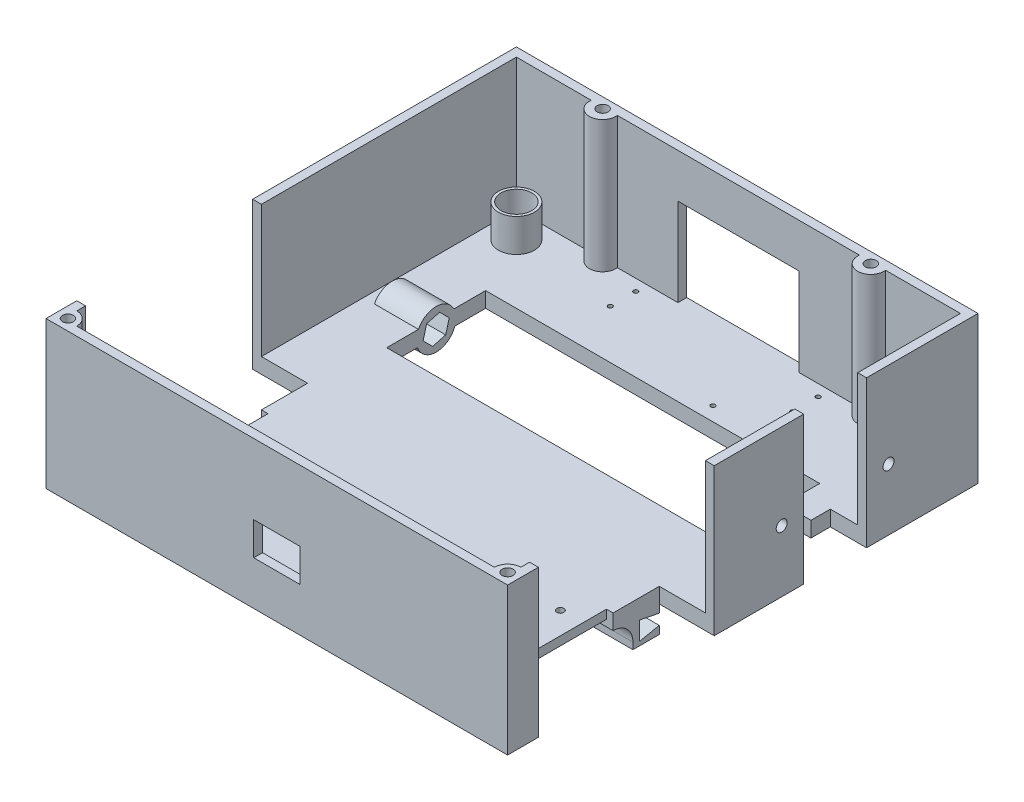
from build123d import *

# Parameters (mm, degrees)
SKETCH1_W           = 210
SKETCH1_H           = 214
BOSS_EXTRUDE1_DEPTH = 7
SKETCH2_W           = 210
SKETCH2_H           = 214
SKETCH2_W_2         = 202
SKETCH2_H_2         = 206
BOSS_EXTRUDE2_DEPTH = 60
SKETCH3_R           = 1.6
CUT_EXTRUDE1_DEPTH  = 306.771156259
SKETCH4_W           = 25
SKETCH4_H           = 80
CUT_EXTRUDE2_DEPTH  = 67
SKETCH5_W           = 42
SKETCH5_H           = 38
CUT_EXTRUDE3_DEPTH  = 3
SKETCH6_W           = 3
SKETCH6_H           = 38
CUT_EXTRUDE4_DEPTH  = 307.581147496
SKETCH7_W           = 152
SKETCH7_H           = 45
CUT_EXTRUDE5_DEPTH  = 306.771156259
SKETCH8_R           = 9
BOSS_EXTRUDE3_DEPTH = 20
SKETCH9_W           = 12.5
SKETCH9_H           = 12
CUT_EXTRUDE6_DEPTH  = 20
SKETCH10_W          = 160
SKETCH10_H          = 12
BOSS_EXTRUDE4_DEPTH = 12
SKETCH11_W          = 9
SKETCH11_H          = 4.8
CUT_EXTRUDE7_DEPTH  = 291.706037089
FILLET1_R           = 9
SKETCH12_R          = 8.2
SKETCH12_R_2        = 7
BOSS_EXTRUDE5_DEPTH = 15
CUT_EXTRUDE8_START  = -12
SKETCH13_R          = 7
CUT_EXTRUDE8_DEPTH  = 12
SKETCH14_W          = 16.5
SKETCH14_H          = 28.6
CUT_EXTRUDE9_DEPTH  = 308.221418524
SKETCH15_W          = 21
SKETCH15_H          = 15
CUT_EXTRUDE10_DEPTH = 30
CUT_EXTRUDE11_DEPTH = 10
BOSS_EXTRUDE6_REACH = 312.06
SKETCH17_R          = 6
CUT_EXTRUDE12_REACH = 312.06
SKETCH18_R          = 2.5
BOSS_EXTRUDE7_REACH = 312.06
SKETCH22_R          = 6
CUT_EXTRUDE14_REACH = 312.06
SKETCH23_R          = 2.5
SKETCH24_R          = 3
SKETCH24_R_2        = 5.798017453
CUT_EXTRUDE15_DEPTH = 3
SKETCH25_R          = 1
CUT_EXTRUDE16_DEPTH = 307.581147496
SKETCH29_W          = 55
SKETCH29_H          = 40
CUT_EXTRUDE17_DEPTH = 17
SKETCH30_R          = 1
CUT_EXTRUDE18_DEPTH = 17
SKETCH31_R          = 2.5
CUT_EXTRUDE19_DEPTH = 17
SKETCH32_W          = 15
SKETCH32_H          = 19
CUT_EXTRUDE20_DEPTH = 3
SKETCH34_R          = 1.5
CUT_EXTRUDE21_DEPTH = 306.771156259


with BuildPart() as part:
    # Sketch1 → Boss-Extrude1 (new body)
    with BuildSketch(Plane(origin=(0, 0, 0), x_dir=(1, 0, 0), z_dir=(0, 1, 0))):
        with Locations((105, 107)):
            Rectangle(SKETCH1_W, SKETCH1_H)
    extrude(amount=BOSS_EXTRUDE1_DEPTH)

    # Sketch2 → Boss-Extrude2 (add)
    with BuildSketch(Plane(origin=(0, 7, 0), x_dir=(1, 0, 0), z_dir=(0, 1, 0))):
        with Locations((105, 107)):
            Rectangle(SKETCH2_W, SKETCH2_H)
        with Locations((105, 107)):
            Rectangle(SKETCH2_W_2, SKETCH2_H_2, mode=Mode.SUBTRACT)
    extrude(amount=BOSS_EXTRUDE2_DEPTH)

    # Sketch3 → Cut-Extrude1 (cut, through all)
    with BuildSketch(Plane(origin=(0, 7, 0), x_dir=(1, 0, 0), z_dir=(0, 1, 0))):
        with Locations(Location((38, 62, 0), (0, 0, 270))):
            Circle(SKETCH3_R)
        with Locations(Location((38, 46, 0), (0, 0, 270))):
            Circle(SKETCH3_R)
        with Locations(Location((52, 62, 0), (0, 0, 270))):
            Circle(SKETCH3_R)
        with Locations(Location((52, 46, 0), (0, 0, 270))):
            Circle(SKETCH3_R)
        with Locations(Location((172, 62, 0), (0, 0, 270))):
            Circle(SKETCH3_R)
        with Locations(Location((172, 46, 0), (0, 0, 270))):
            Circle(SKETCH3_R)
        with Locations(Location((158, 62, 0), (0, 0, 270))):
            Circle(SKETCH3_R)
        with Locations(Location((158, 46, 0), (0, 0, 270))):
            Circle(SKETCH3_R)
    extrude(amount=-CUT_EXTRUDE1_DEPTH, mode=Mode.SUBTRACT)

    # Sketch4 → Cut-Extrude2 (cut)
    with BuildSketch(Plane(origin=(0, 0, 0), x_dir=(-1, 0, 0), z_dir=(0, -1, 0))):
        with Locations((-12.5, 54)):
            Rectangle(SKETCH4_W, SKETCH4_H)
        with Locations((-197.5, 54)):
            Rectangle(SKETCH4_W, SKETCH4_H)
    extrude(amount=-CUT_EXTRUDE2_DEPTH, mode=Mode.SUBTRACT)

    # Sketch5 → Cut-Extrude3 (cut)
    with BuildSketch(Plane(origin=(0, 0, 0), x_dir=(-1, 0, 0), z_dir=(0, -1, 0))):
        with Locations((-46, 54)):
            Rectangle(SKETCH5_W, SKETCH5_H)
        with Locations((-164, 54)):
            Rectangle(SKETCH5_W, SKETCH5_H)
    extrude(amount=-CUT_EXTRUDE3_DEPTH, mode=Mode.SUBTRACT)

    # Sketch6 → Cut-Extrude4 (cut, through all)
    with BuildSketch(Plane.XZ.offset(-3)):
        with Locations((26.5, -54)):
            Rectangle(SKETCH6_W, SKETCH6_H)
        with Locations((183.5, -54)):
            Rectangle(SKETCH6_W, SKETCH6_H)
    extrude(amount=-CUT_EXTRUDE4_DEPTH, mode=Mode.SUBTRACT)

    # Sketch7 → Cut-Extrude5 (cut, through all)
    with BuildSketch(Plane(origin=(0, 7, 0), x_dir=(1, 0, 0), z_dir=(0, 1, 0))):
        with Locations((105, 148.5)):
            Rectangle(SKETCH7_W, SKETCH7_H)
    extrude(amount=-CUT_EXTRUDE5_DEPTH, mode=Mode.SUBTRACT)

    # Sketch8 → Boss-Extrude3 (add)
    with BuildSketch(Plane(origin=(29, 0, 0), x_dir=(0, 0, -1), z_dir=(1, 0, 0))):
        with Locations((148.5, 3)):
            Circle(SKETCH8_R)
    extrude(amount=-BOSS_EXTRUDE3_DEPTH)

    # Sketch9 → Cut-Extrude6 (cut)
    with BuildSketch(Plane(origin=(0, 7, 0), x_dir=(1, 0, 0), z_dir=(0, 1, 0))):
        with Locations((187.25, 148.5)):
            Rectangle(SKETCH9_W, SKETCH9_H)
    extrude(amount=-CUT_EXTRUDE6_DEPTH, mode=Mode.SUBTRACT)

    # Sketch10 → Boss-Extrude4 (add)
    with BuildSketch(Plane.XZ):
        with Locations((105, -88)):
            Rectangle(SKETCH10_W, SKETCH10_H)
    extrude(amount=BOSS_EXTRUDE4_DEPTH)

    # Sketch11 → Cut-Extrude7 (cut, through all)
    with BuildSketch(Plane.ZY.offset(-25)):
        with Locations((-89.5, -6)):
            Rectangle(SKETCH11_W, SKETCH11_H)
        Polygon((-85, -3.6), (-85, -1.8), (-94, -3.6), align=None)
        Polygon((-85, -10.2), (-94, -8.4), (-85, -8.4), align=None)
    extrude(amount=-CUT_EXTRUDE7_DEPTH, mode=Mode.SUBTRACT)

    # Fillet1
    fillet1_edges = [part.edges().sort_by_distance(p)[0] for p in [
        (105, 0, -82),
    ]]
    fillet(fillet1_edges, radius=FILLET1_R)

    # Sketch12 → Boss-Extrude5 (add)
    # profile 1 of 2: a face of its own
    with BuildSketch(Plane(origin=(0, 7, 0), x_dir=(1, 0, 0), z_dir=(0, 1, 0))):
        with Locations(Location((16, 198, 0), (0, 0, 90))):
            Circle(SKETCH12_R)
        with Locations(Location((16, 198, 0), (0, 0, 270))):
            Circle(SKETCH12_R_2, mode=Mode.SUBTRACT)
    # profile 2 of 2: a face of its own
    with BuildSketch(Plane(origin=(0, 7, 0), x_dir=(1, 0, 0), z_dir=(0, 1, 0))):
        with Locations(Location((194, 198, 0), (0, 0, 90))):
            Circle(SKETCH12_R)
        with Locations(Location((194, 198, 0), (0, 0, 270))):
            Circle(SKETCH12_R_2, mode=Mode.SUBTRACT)
    extrude(amount=BOSS_EXTRUDE5_DEPTH)

    # Sketch13 → Cut-Extrude8 (cut)
    with BuildSketch(Plane(origin=(0, 7, 0), x_dir=(1, 0, 0), z_dir=(0, 1, 0)).offset(CUT_EXTRUDE8_START)):
        with Locations(Location((16, 198, 0), (0, 0, 90))):
            Circle(SKETCH13_R)
        with Locations(Location((194, 198, 0), (0, 0, 90))):
            Circle(SKETCH13_R)
    extrude(amount=CUT_EXTRUDE8_DEPTH, mode=Mode.SUBTRACT)

    # Sketch14 → Cut-Extrude9 (cut, through all)
    with BuildSketch(Plane.XZ):
        with Locations((201.75, -148.99190775)):
            Rectangle(SKETCH14_W, SKETCH14_H)
    extrude(amount=-CUT_EXTRUDE9_DEPTH, mode=Mode.SUBTRACT)

    # Sketch15 → Cut-Extrude10 (cut)
    with BuildSketch(Plane.XY):
        with Locations((105, 27.5)):
            Rectangle(SKETCH15_W, SKETCH15_H)
    extrude(amount=-CUT_EXTRUDE10_DEPTH, mode=Mode.SUBTRACT)

    # Sketch16 → Cut-Extrude11 (cut)
    with BuildSketch(Plane(origin=(29, 0, 0), x_dir=(0, 0, -1), z_dir=(1, 0, 0))):
        Polygon((154.446285201, 4.569774603), (150.113677916, 8.934521344), (144.167392715, 7.364746741), (142.553714799, 1.430225397), (146.886322084, -2.934521344), (152.832607285, -1.364746741), align=None)
    extrude(amount=-CUT_EXTRUDE11_DEPTH, mode=Mode.SUBTRACT)

    # Sketch17 → Boss-Extrude6 (add, up to next)
    with BuildSketch(Plane(origin=(0, 67, 0), x_dir=(1, 0, 0), z_dir=(0, 1, 0)), mode=Mode.PRIVATE) as boss_extrude6_sk1:
        with Locations((4, 4)):
            Circle(SKETCH17_R)
    boss_extrude6_tool1 = extrude(boss_extrude6_sk1.sketch, amount=-BOSS_EXTRUDE6_REACH, mode=Mode.PRIVATE) - part.part
    # Sketch17 → Boss-Extrude6 (add, up to next)
    with BuildSketch(Plane(origin=(0, 67, 0), x_dir=(1, 0, 0), z_dir=(0, 1, 0)), mode=Mode.PRIVATE) as boss_extrude6_sk2:
        with Locations((206, 4)):
            Circle(SKETCH17_R)
    boss_extrude6_tool2 = extrude(boss_extrude6_sk2.sketch, amount=-BOSS_EXTRUDE6_REACH, mode=Mode.PRIVATE) - part.part
    add(boss_extrude6_tool1.solids().sort_by_distance((4, 67, -4))[0])
    add(boss_extrude6_tool2.solids().sort_by_distance((206, 67, -4))[0])

    # Sketch18 → Cut-Extrude12 (cut, up to next)
    with BuildSketch(Plane(origin=(0, 67, 0), x_dir=(1, 0, 0), z_dir=(0, 1, 0)), mode=Mode.PRIVATE) as cut_extrude12_sk1:
        with Locations(Location((5, 5, 0), (0, 0, 270))):
            Circle(SKETCH18_R)
    cut_extrude12_tool1 = extrude(cut_extrude12_sk1.sketch, amount=-CUT_EXTRUDE12_REACH, mode=Mode.PRIVATE) & part.part
    # Sketch18 → Cut-Extrude12 (cut, up to next)
    with BuildSketch(Plane(origin=(0, 67, 0), x_dir=(1, 0, 0), z_dir=(0, 1, 0)), mode=Mode.PRIVATE) as cut_extrude12_sk2:
        with Locations(Location((205, 5, 0), (0, 0, 270))):
            Circle(SKETCH18_R)
    cut_extrude12_tool2 = extrude(cut_extrude12_sk2.sketch, amount=-CUT_EXTRUDE12_REACH, mode=Mode.PRIVATE) & part.part
    add(cut_extrude12_tool1.solids().sort_by_distance((5, 67, -5))[0], mode=Mode.SUBTRACT)
    add(cut_extrude12_tool2.solids().sort_by_distance((205, 67, -5))[0], mode=Mode.SUBTRACT)

    # Sketch22 → Boss-Extrude7 (add, up to next)
    with BuildSketch(Plane(origin=(0, 67, 0), x_dir=(1, 0, 0), z_dir=(0, 1, 0)), mode=Mode.PRIVATE) as boss_extrude7_sk1:
        with Locations((43.99, 209.23)):
            Circle(SKETCH22_R)
    boss_extrude7_tool1 = extrude(boss_extrude7_sk1.sketch, amount=-BOSS_EXTRUDE7_REACH, mode=Mode.PRIVATE) - part.part
    # Sketch22 → Boss-Extrude7 (add, up to next)
    with BuildSketch(Plane(origin=(0, 67, 0), x_dir=(1, 0, 0), z_dir=(0, 1, 0)), mode=Mode.PRIVATE) as boss_extrude7_sk2:
        with Locations((166.01, 209.23)):
            Circle(SKETCH22_R)
    boss_extrude7_tool2 = extrude(boss_extrude7_sk2.sketch, amount=-BOSS_EXTRUDE7_REACH, mode=Mode.PRIVATE) - part.part
    add(boss_extrude7_tool1.solids().sort_by_distance((43.99, 67, -209.23))[0])
    add(boss_extrude7_tool2.solids().sort_by_distance((166.01, 67, -209.23))[0])

    # Sketch23 → Cut-Extrude14 (cut, up to next)
    with BuildSketch(Plane(origin=(0, 67, 0), x_dir=(1, 0, 0), z_dir=(0, 1, 0)), mode=Mode.PRIVATE) as cut_extrude14_sk1:
        with Locations(Location((43.99, 209.23, 0), (0, 0, 270))):
            Circle(SKETCH23_R)
    cut_extrude14_tool1 = extrude(cut_extrude14_sk1.sketch, amount=-CUT_EXTRUDE14_REACH, mode=Mode.PRIVATE) & part.part
    # Sketch23 → Cut-Extrude14 (cut, up to next)
    with BuildSketch(Plane(origin=(0, 67, 0), x_dir=(1, 0, 0), z_dir=(0, 1, 0)), mode=Mode.PRIVATE) as cut_extrude14_sk2:
        with Locations(Location((166.01, 209.23, 0), (0, 0, 270))):
            Circle(SKETCH23_R)
    cut_extrude14_tool2 = extrude(cut_extrude14_sk2.sketch, amount=-CUT_EXTRUDE14_REACH, mode=Mode.PRIVATE) & part.part
    add(cut_extrude14_tool1.solids().sort_by_distance((43.99, 67, -209.23))[0], mode=Mode.SUBTRACT)
    add(cut_extrude14_tool2.solids().sort_by_distance((166.01, 67, -209.23))[0], mode=Mode.SUBTRACT)

    # Sketch24 → Cut-Extrude15 (cut)
    with BuildSketch(Plane(origin=(0, 0, 0), x_dir=(-1, 0, 0), z_dir=(0, -1, 0))):
        with Locations((-63.5, 204.798017453)):
            Circle(SKETCH24_R)
        with Locations((-63.5, 199)):
            Circle(SKETCH24_R_2)
        with Locations((-63.5, 193.201982547)):
            Circle(SKETCH24_R)
        with Locations((-146.5, 199)):
            Circle(SKETCH24_R_2)
        with Locations((-146.5, 204.798017453)):
            Circle(SKETCH24_R)
        with Locations((-146.5, 193.201982547)):
            Circle(SKETCH24_R)
    extrude(amount=-CUT_EXTRUDE15_DEPTH, mode=Mode.SUBTRACT)

    # Sketch25 → Cut-Extrude16 (cut, through all)
    with BuildSketch(Plane(origin=(0, 3, 0), x_dir=(-1, 0, 0), z_dir=(0, -1, 0))):
        with Locations(Location((-146.5, 204.798017453, 0), (0, 0, 90))):
            Circle(SKETCH25_R)
        with Locations(Location((-146.5, 193.201982547, 0), (0, 0, 90))):
            Circle(SKETCH25_R)
        with Locations(Location((-63.5, 193.201982547, 0), (0, 0, 90))):
            Circle(SKETCH25_R)
        with Locations(Location((-63.5, 204.798017453, 0), (0, 0, 90))):
            Circle(SKETCH25_R)
    extrude(amount=-CUT_EXTRUDE16_DEPTH, mode=Mode.SUBTRACT)

    # Sketch29 → Cut-Extrude17 (cut)
    with BuildSketch(Plane.XY.offset(-210)):
        with Locations((105, 27)):
            Rectangle(SKETCH29_W, SKETCH29_H)
    extrude(amount=-CUT_EXTRUDE17_DEPTH, mode=Mode.SUBTRACT)

    # Sketch30 → Cut-Extrude18 (cut)
    with BuildSketch(Plane(origin=(0, 7, 0), x_dir=(1, 0, 0), z_dir=(0, 1, 0))):
        with Locations(Location((126.03337695, 177.379260447, 0), (0, 0, 270))):
            Circle(SKETCH30_R)
    extrude(amount=-CUT_EXTRUDE18_DEPTH, mode=Mode.SUBTRACT)

    # Sketch31 → Cut-Extrude19 (cut)
    with BuildSketch(Plane(origin=(210, 0, 0), x_dir=(0, 0, -1), z_dir=(1, 0, 0))):
        with Locations((124.69190775, 28)):
            Circle(SKETCH31_R)
        with Locations((173.29190775, 28)):
            Circle(SKETCH31_R)
    extrude(amount=-CUT_EXTRUDE19_DEPTH, mode=Mode.SUBTRACT)

    # Sketch32 → Cut-Extrude20 (cut)
    with BuildSketch(Plane(origin=(0, 0, 0), x_dir=(-1, 0, 0), z_dir=(0, -1, 0))):
        with Locations((-63.5, 199)):
            Rectangle(SKETCH32_W, SKETCH32_H)
        with Locations((-146.5, 199.034633879)):
            Rectangle(SKETCH32_W, SKETCH32_H)
    extrude(amount=-CUT_EXTRUDE20_DEPTH, mode=Mode.SUBTRACT)

    # Sketch34 → Cut-Extrude21 (cut, through all)
    with BuildSketch(Plane(origin=(0, 7, 0), x_dir=(1, 0, 0), z_dir=(0, 1, 0))):
        with Locations(Location((75.507390147, 13.977394752, 0), (0, 0, 270))):
            Circle(SKETCH34_R)
    extrude(amount=-CUT_EXTRUDE21_DEPTH, mode=Mode.SUBTRACT)


solid = part.part
